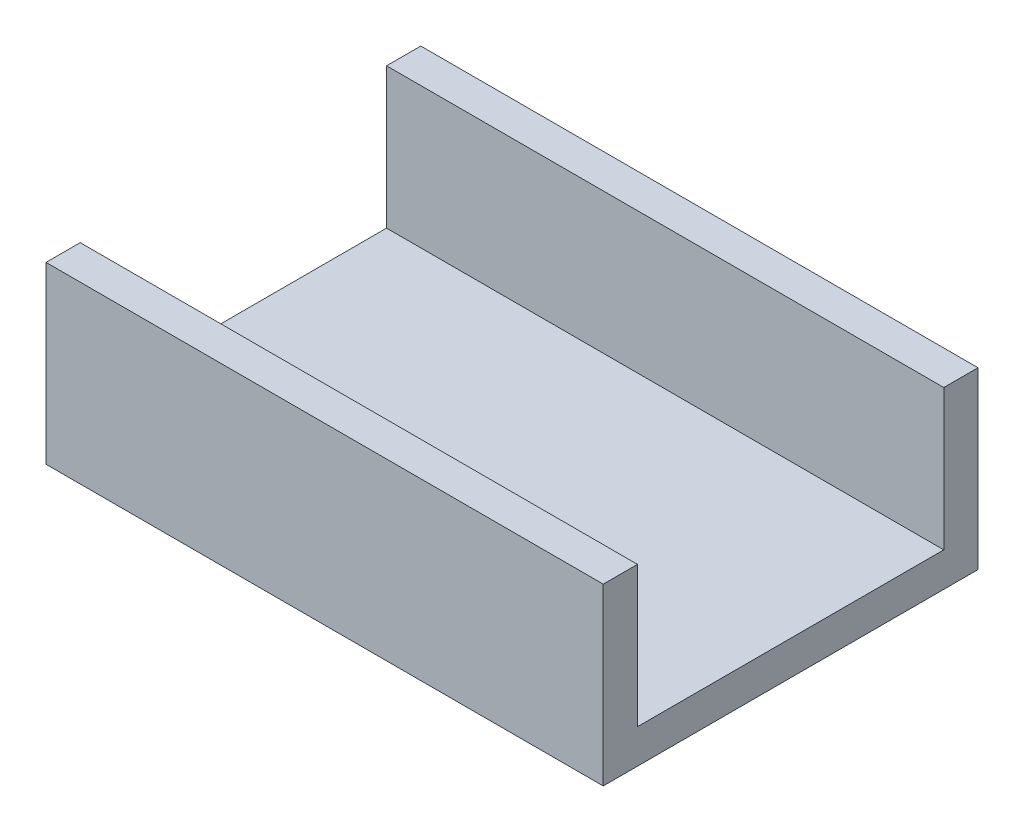
from build123d import *

# Parameters (mm, degrees)
SKETCH1_W           = 162.841056138
SKETCH1_H           = 109.517788384
BOSS_EXTRUDE1_DEPTH = 10
SKETCH3_W           = 162.841056138
SKETCH3_H           = 41.085879715
BOSS_EXTRUDE2_DEPTH = 10


with BuildPart() as part:
    # Sketch1 → Boss-Extrude1 (new body)
    with BuildSketch(Plane(origin=(0, 0, 0), x_dir=(1, 0, 0), z_dir=(0, 1, 0))):
        Rectangle(SKETCH1_W, SKETCH1_H)
    extrude(amount=BOSS_EXTRUDE1_DEPTH)

    # Sketch3 → Boss-Extrude2 (add)
    with BuildSketch(Plane.XY.offset(54.758894192)):
        with Locations((0, 30.542939858)):
            Rectangle(SKETCH3_W, SKETCH3_H)
    boss_extrude2 = extrude(amount=-BOSS_EXTRUDE2_DEPTH)

    # Mirror1: Boss-Extrude2 across plane
    add(boss_extrude2.mirror(Plane.XY))


solid = part.part
